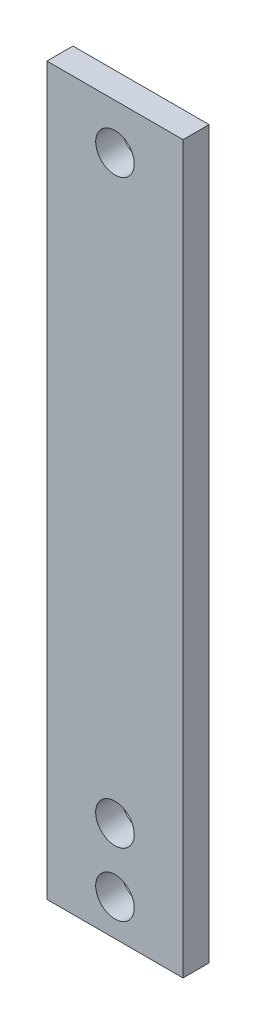
from build123d import *

# Parameters (mm, degrees)
SKETCH1_W           = 15
SKETCH1_H           = 80
SKETCH1_R           = 2.125
BOSS_EXTRUDE1_DEPTH = 2.87


with BuildPart() as part:
    # Sketch1 → Boss-Extrude1 (new body)
    with BuildSketch(Plane.XY):
        Rectangle(SKETCH1_W, SKETCH1_H)
        with Locations((0, -36)):
            Circle(SKETCH1_R, mode=Mode.SUBTRACT)
        with Locations((0, -29)):
            Circle(SKETCH1_R, mode=Mode.SUBTRACT)
        with Locations((0, 35)):
            Circle(SKETCH1_R, mode=Mode.SUBTRACT)
    extrude(amount=BOSS_EXTRUDE1_DEPTH)


solid = part.part
